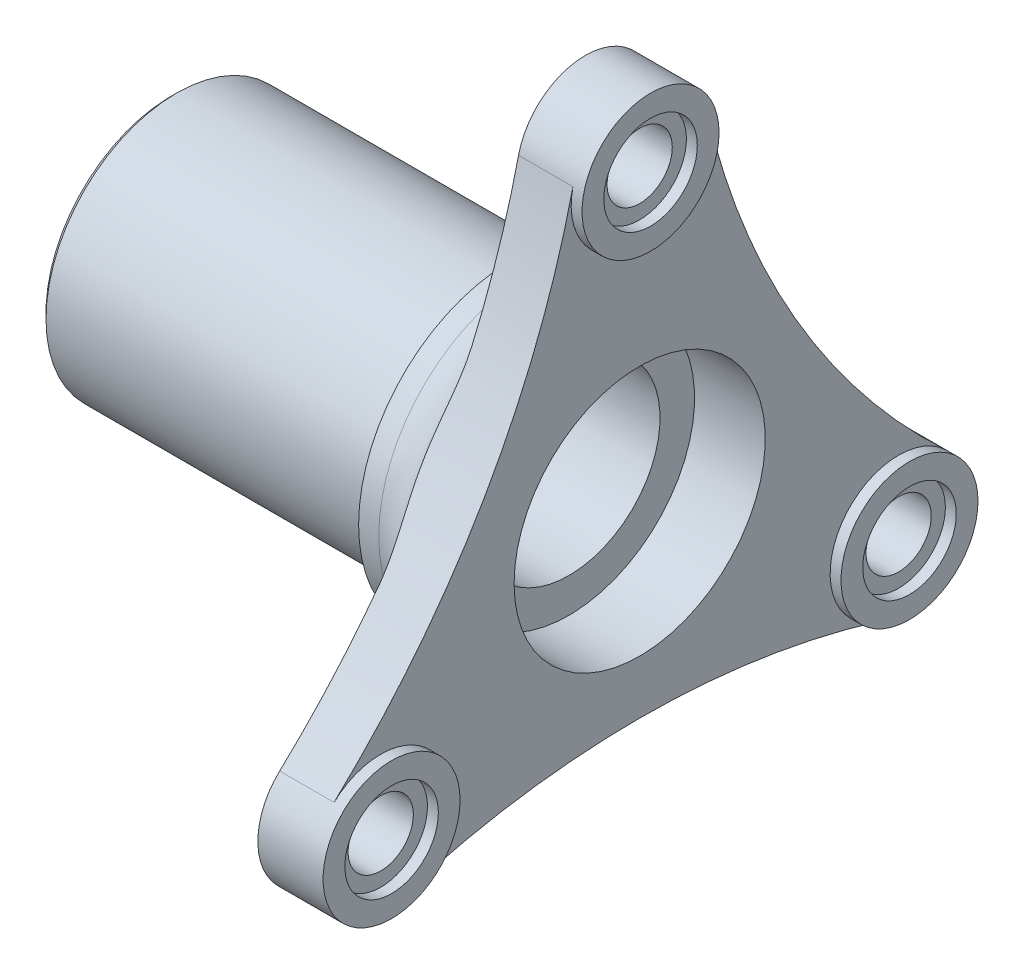
from build123d import *

# Parameters (mm, degrees)
CHAMFER1_SIZE       = 1
FILLET1_R           = 10
SKETCH2_R           = 6
CUT_EXTRUDE1_DEPTH  = 30
BOSS_EXTRUDE1_START = 2
SKETCH3_R           = 12.6
SKETCH3_R_2         = 8.6
BOSS_EXTRUDE1_DEPTH = 2


with BuildPart() as part:
    # Sketch1 → Revolve1 (revolve)
    with BuildSketch(Plane.XY, mode=Mode.PRIVATE) as revolve1_sk:
        Polygon((0, 24), (62.5, 24), (62.5, 28), (76.2, 28), (76.2, 67.6), (86.2, 67.6), (86.2, 23.1), (73.2, 23.1), (73.2, 16.75), (17.45, 16.75), (15.7, 18.5), (11.8, 18.5), (11.8, 20.6), (0, 20.6), align=None)
    revolve(revolve1_sk.sketch.rotate(Axis((0, 0, 0), (1, 0, 0)), 90), axis=Axis((0, 0, 0), (1, 0, 0)))

    # Chamfer1
    chamfer1_edges = [part.edges().sort_by_distance(p)[0] for p in [
        (0, 0, -24),
        (0, 0, -20.6),
    ]]
    chamfer(chamfer1_edges, length=CHAMFER1_SIZE)

    # Fillet1
    fillet1_edges = [part.edges().sort_by_distance(p)[0] for p in [
        (76.2, 0, -28),
    ]]
    fillet(fillet1_edges, radius=FILLET1_R)

    # Sketch2 → Cut-Extrude1 (cut)
    with BuildSketch(Plane(origin=(86.2, 0, 0), x_dir=(0, 0, -1), z_dir=(1, 0, 0))):
        with BuildLine():
            ThreePointArc((-58.543317297, -33.799999998), (-60.092446992, -25.63392436), (-56.219136733, -18.279873653))
            ThreePointArc((-56.219136733, -18.279873653), (-28.550320514, 16.483535234), (-12.278733405, 57.827137417))
            ThreePointArc((-12.278733405, 57.827137417), (-7.846593801, 64.858547851), (0, 67.6))
            ThreePointArc((0, 67.6), (-58.543317295, 33.800000001), (-58.543317297, -33.799999998))
        make_face()
        with BuildLine():
            ThreePointArc((67.6, 0), (47.800418408, 47.800418408), (0, 67.6))
            ThreePointArc((0, 67.6), (7.846593801, 64.858547851), (12.278733405, 57.827137417))
            ThreePointArc((12.278733405, 57.827137417), (28.550320514, 16.483535234), (56.219136733, -18.279873653))
            ThreePointArc((56.219136733, -18.279873653), (60.092446945, -25.633924049), (58.543317611, -33.799999453))
            ThreePointArc((58.543317611, -33.799999453), (65.296585939, -17.496167144), (67.6, 0))
        make_face()
        with BuildLine():
            ThreePointArc((-43.940403329, -39.547263763), (-52.245853192, -39.22462349), (-58.543317297, -33.799999998))
            ThreePointArc((-58.543317297, -33.799999998), (3.14e-07, -67.6), (58.543317611, -33.799999453))
            ThreePointArc((58.543317611, -33.799999453), (52.245853485, -39.224623374), (43.940403329, -39.547263763))
            ThreePointArc((43.940403329, -39.547263763), (0, -32.967070468), (-43.940403329, -39.547263763))
        make_face()
        with Locations((47.631397208, -27.5)):
            Circle(SKETCH2_R)
        with Locations((-47.631397208, -27.5)):
            Circle(SKETCH2_R)
        with Locations((0, 55)):
            Circle(SKETCH2_R)
    extrude(amount=-CUT_EXTRUDE1_DEPTH, mode=Mode.SUBTRACT)

    # Sketch3 → Boss-Extrude1 (add)
    # profile 1 of 3: a face of its own
    with BuildSketch(Plane(origin=(86.2, 0, 0), x_dir=(0, 0, -1), z_dir=(1, 0, 0)).offset(BOSS_EXTRUDE1_START)):
        with Locations((0, 55)):
            Circle(SKETCH3_R)
        with Locations((0, 55)):
            Circle(SKETCH3_R_2, mode=Mode.SUBTRACT)
    # profile 2 of 3: a face of its own
    with BuildSketch(Plane(origin=(86.2, 0, 0), x_dir=(0, 0, -1), z_dir=(1, 0, 0)).offset(BOSS_EXTRUDE1_START)):
        with Locations((47.631397208, -27.5)):
            Circle(SKETCH3_R)
        with Locations((47.631397208, -27.5)):
            Circle(SKETCH3_R_2, mode=Mode.SUBTRACT)
    # profile 3 of 3: a face of its own
    with BuildSketch(Plane(origin=(86.2, 0, 0), x_dir=(0, 0, -1), z_dir=(1, 0, 0)).offset(BOSS_EXTRUDE1_START)):
        with Locations((-47.631397208, -27.5)):
            Circle(SKETCH3_R)
        with Locations((-47.631397208, -27.5)):
            Circle(SKETCH3_R_2, mode=Mode.SUBTRACT)
    extrude(amount=-BOSS_EXTRUDE1_DEPTH)


solid = part.part
